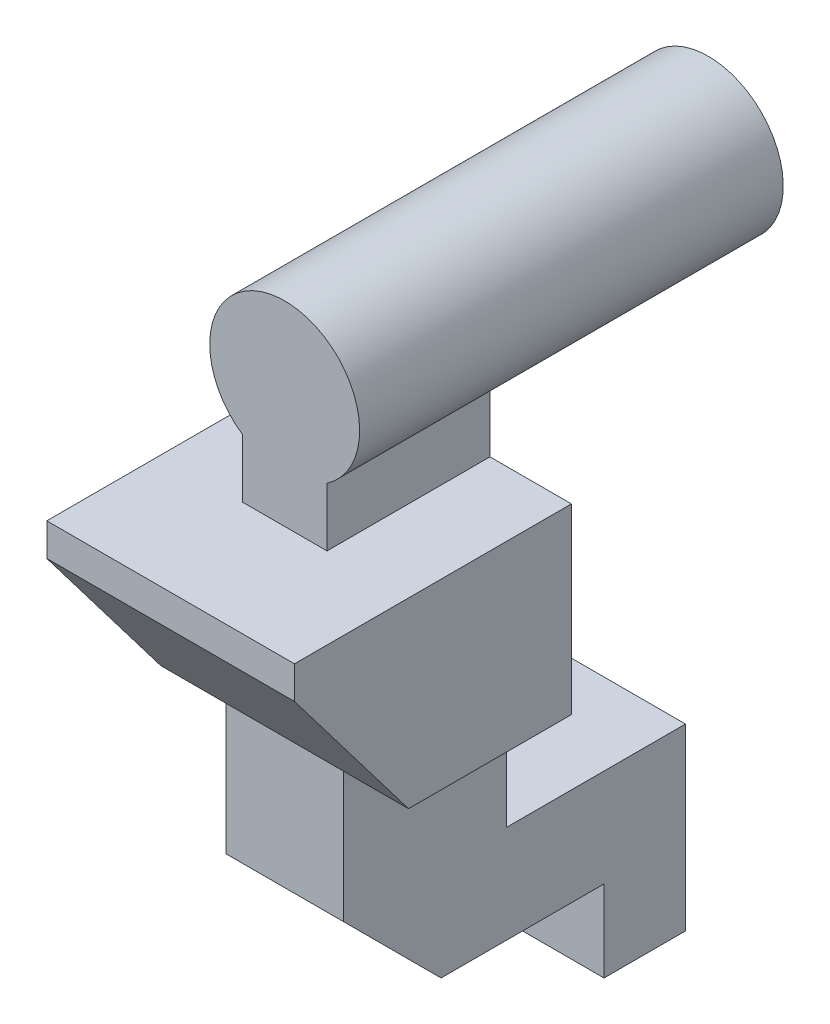
from build123d import *

# Parameters (mm, degrees)
SZKIC1_W                    = 7.6
SZKIC1_H                    = 5.6
DODANIE_WYCI_GNI_CIE1_DEPTH = 5
SZKIC2_R                    = 2.3
SZKIC2_W                    = 2.6
SZKIC2_H                    = 1.8
DODANIE_WYCI_GNI_CIE2_DEPTH = 5
SZKIC3_W                    = 3.6
SZKIC3_H                    = 7
DODANIE_WYCI_GNI_CIE3_DEPTH = 5
SZKIC4_R                    = 2.3
DODANIE_WYCI_GNI_CIE4_DEPTH = 8
SFAZOWANIE1_SIZE            = 3
DODANIE_WYCI_GNI_CIE5_DEPTH = 7.6
DODANIE_WYCI_GNI_CIE6_DEPTH = 3.6


with BuildPart() as part:
    # Szkic1 → Dodanie-wyciągnięcie1 (new body)
    with BuildSketch(Plane.XY):
        Rectangle(SZKIC1_W, SZKIC1_H)
    extrude(amount=DODANIE_WYCI_GNI_CIE1_DEPTH)

    # Szkic2 → Dodanie-wyciągnięcie2 (add)
    with BuildSketch(Plane.XY.offset(5)):
        with Locations((0, 6.497366596)):
            Circle(SZKIC2_R)
        with Locations((0, 3.7)):
            Rectangle(SZKIC2_W, SZKIC2_H)
    extrude(amount=-DODANIE_WYCI_GNI_CIE2_DEPTH)

    # Szkic3 → Dodanie-wyciągnięcie3 (add)
    with BuildSketch(Plane.XY.offset(5)):
        with Locations((0, -6.3)):
            Rectangle(SZKIC3_W, SZKIC3_H)
    extrude(amount=-DODANIE_WYCI_GNI_CIE3_DEPTH)

    # Szkic4 → Dodanie-wyciągnięcie4 (add)
    with BuildSketch(Plane(origin=(0, 0, 0), x_dir=(-1, 0, 0), z_dir=(0, 0, -1))):
        with Locations(Location((0, 6.497366596, 0), (0, 0, 235.58261129))):
            Circle(SZKIC4_R)
    extrude(amount=DODANIE_WYCI_GNI_CIE4_DEPTH)

    # Sfazowanie1
    sfazowanie1_edges = [part.edges().sort_by_distance(p)[0] for p in [
        (0, -9.8, 5),
    ]]
    chamfer(sfazowanie1_edges, length=SFAZOWANIE1_SIZE)

    # Szkic5 → Dodanie-wyciągnięcie5 (add)
    with BuildSketch(Plane(origin=(3.8, 0, 0), x_dir=(0, 0, -1), z_dir=(1, 0, 0))):
        Polygon((-5, 2.8), (-8.5, 2.8), (-8.5, 1.8), (-5, -2.8), align=None)
    extrude(amount=-DODANIE_WYCI_GNI_CIE5_DEPTH)

    # Szkic6 → Dodanie-wyciągnięcie6 (add)
    with BuildSketch(Plane.ZY.offset(1.8)):
        Polygon((0, -9.8), (-3, -9.8), (-3, -12.3), (-5.5, -12.3), (-5.5, -6.8), (0, -6.8), align=None)
    extrude(amount=-DODANIE_WYCI_GNI_CIE6_DEPTH)


solid = part.part
